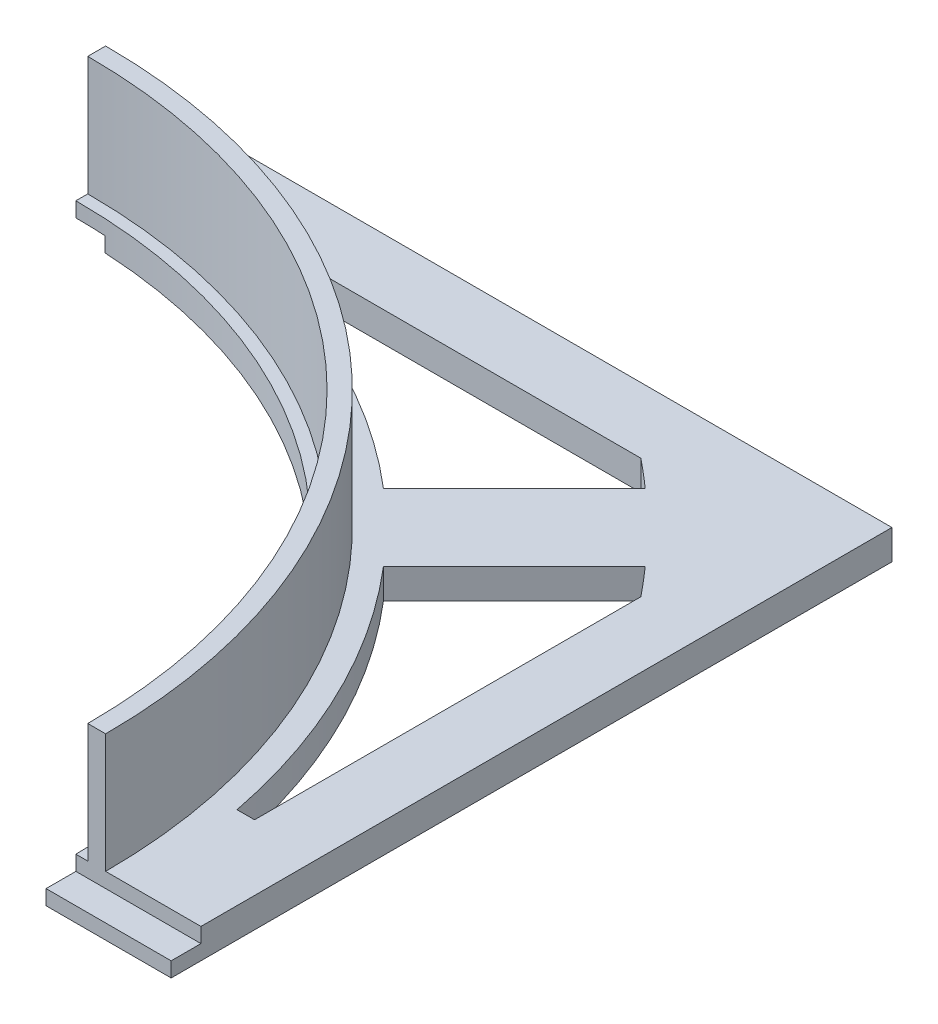
from build123d import *

# Parameters (mm, degrees)
EXTRUDE_1_DEPTH     = 5
EXTRUDE_2_DEPTH     = 20
CUT_EXTRUDE_1_DEPTH = 166.263426081
CUT_EXTRUDE_2_DEPTH = 2.5
SKETCH_6_W          = 21
SKETCH_6_H          = 5
EXTRUDE_3_DEPTH     = 2.5


with BuildPart() as part:
    # 스케치1 → 보스-돌출1 (new body)
    with BuildSketch(Plane(origin=(0, 0, 0), x_dir=(1, 0, 0), z_dir=(0, 1, 0))):
        with BuildLine():
            Line((0, 95), (0, 116))
            Line((0, 116), (116, 116))
            Line((116, 116), (116, 0))
            Line((116, 0), (95, 0))
            ThreePointArc((95, 0), (67.175144213, 67.175144213), (0, 95))
        make_face()
    extrude(amount=EXTRUDE_1_DEPTH)

    # 스케치2 → 보스-돌출2 (add)
    with BuildSketch(Plane(origin=(0, 5, 0), x_dir=(1, 0, 0), z_dir=(0, 1, 0))):
        with BuildLine():
            Line((97, 0), (100, 0))
            ThreePointArc((100, 0), (70.710678119, 70.710678119), (0, 100))
            Line((0, 100), (0, 97))
            ThreePointArc((0, 97), (68.589357775, 68.589357775), (97, 0))
        make_face()
    extrude(amount=EXTRUDE_2_DEPTH)

    # 스케치3 → 컷-돌출1 (cut, through all)
    with BuildSketch(Plane(origin=(0, 5, 0), x_dir=(1, 0, 0), z_dir=(0, 1, 0))):
        with BuildLine():
            Line((20, 105), (84.852813742, 105))
            ThreePointArc((84.852813742, 105), (87.267323582, 103.002010829), (89.634803308, 100.948511807))
            Line((89.634803308, 100.948511807), (67.66435687, 78.978065369))
            ThreePointArc((67.66435687, 78.978065369), (45.325930989, 93.603204966), (20, 102.058806577))
            Line((20, 102.058806577), (20, 105))
        make_face()
        with BuildLine():
            Line((105, 84.852813742), (105, 20))
            Line((105, 20), (102.058806577, 20))
            ThreePointArc((102.058806577, 20), (93.603204966, 45.325930989), (78.978065369, 67.66435687))
            Line((78.978065369, 67.66435687), (100.948511807, 89.634803308))
            ThreePointArc((100.948511807, 89.634803308), (103.002010829, 87.267323582), (105, 84.852813742))
        make_face()
    extrude(amount=-CUT_EXTRUDE_1_DEPTH, mode=Mode.SUBTRACT)

    # 스케치5 → 컷-돌출2 (cut)
    with BuildSketch(Plane.XZ):
        Polygon((0, -95), (0, -116), (5, -116), (5, -94.868329805), align=None)
    extrude(amount=-CUT_EXTRUDE_2_DEPTH, mode=Mode.SUBTRACT)

    # 스케치6 → 보스-돌출3 (add)
    with BuildSketch(Plane(origin=(0, 0, 0), x_dir=(1, 0, 0), z_dir=(0, 1, 0))):
        with Locations((105.5, -2.5)):
            Rectangle(SKETCH_6_W, SKETCH_6_H)
    extrude(amount=EXTRUDE_3_DEPTH)


solid = part.part
